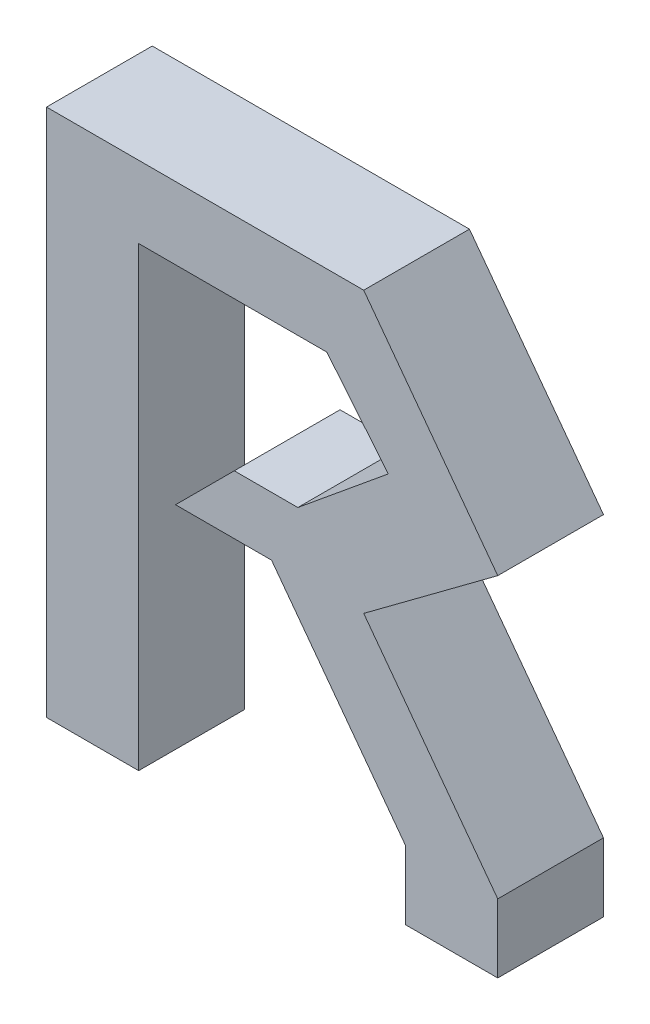
from build123d import *

# Parameters (mm, degrees)
BOSS_EXTRUDE1_DEPTH = 20


with BuildPart() as part:
    # Sketch1 → Boss-Extrude1 (new body)
    with BuildSketch(Plane.XY):
        Polygon((-308.048152534, 51.533481949), (-308.048152534, -48.466518051), (-290.618276034, -48.466518051), (-290.618276034, 37.897118312), (-255.017849504, 37.897118312), (-243.401687888, 23.755704171), (-260.510631621, 9.701928961), (-272.52973086, 9.701928961), (-283.644605108, -1.412945287), (-265.478028988, -1.412945287), (-240.124493635, -35.503854378), (-240.124493635, -48.466518051), (-222.694617181, -48.466518051), (-222.694617181, -35.503854378), (-248.048152534, -1.412945287), (-222.694617181, 17.442572858), (-248.048152534, 51.533481949), align=None)
    extrude(amount=BOSS_EXTRUDE1_DEPTH)


solid = part.part
